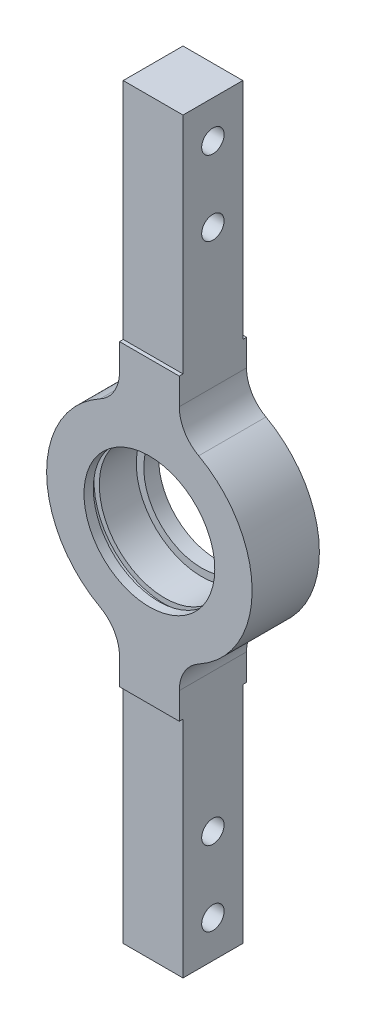
from build123d import *

# Parameters (mm, degrees)
SKETCH1_R           = 27.5
SKETCH1_R_2         = 15.5
BOSS_EXTRUDE1_DEPTH = 9
BOSS_EXTRUDE2_DEPTH = 9
SKETCH3_W           = 14
SKETCH3_H           = 2
SKETCH4_W           = 1.6
SKETCH4_H           = 1.9
FILLET1_R           = 10
SKETCH5_W           = 16
SKETCH5_H           = 1
CUT_EXTRUDE1_DEPTH  = 60
SKETCH6_R           = 3
CUT_EXTRUDE2_DEPTH  = 107.495305061
SKETCH7_R           = 3
CUT_EXTRUDE3_DEPTH  = 107.495305061


with BuildPart() as part:
    # Sketch1 → Boss-Extrude1 (new, symmetric)
    with BuildSketch(Plane.XY):
        Circle(SKETCH1_R)
        Circle(SKETCH1_R_2, mode=Mode.SUBTRACT)
    extrude(amount=BOSS_EXTRUDE1_DEPTH, both=True)

    # Sketch2 → Boss-Extrude2 (add, symmetric)
    with BuildSketch(Plane.XY):
        Polygon((-8, 100), (8, 100), (8, 26.310644234), (0, 27.5), (-8, 26.310644234), align=None)
    boss_extrude2 = extrude(amount=BOSS_EXTRUDE2_DEPTH, both=True)

    # Mirror1: Boss-Extrude2 across plane
    add(boss_extrude2.mirror(Plane.ZX))

    # Sketch3 → Cut-Revolve1 (revolve, cut)
    with BuildSketch(Plane(origin=(0, 0, 0), x_dir=(0, 0, -1), z_dir=(1, 0, 0)), mode=Mode.PRIVATE) as cut_revolve1_sk:
        with Locations((-2, 16.5)):
            Rectangle(SKETCH3_W, SKETCH3_H)
    revolve(cut_revolve1_sk.sketch.rotate(Axis((0, 0, 0), (0, 0, -1)), 90), axis=Axis((0, 0, 0), (0, 0, -1)), mode=Mode.SUBTRACT)

    # Sketch4 → Cut-Revolve2 (revolve, cut)
    with BuildSketch(Plane(origin=(0, 0, 0), x_dir=(0, 0, -1), z_dir=(1, 0, 0)), mode=Mode.PRIVATE) as cut_revolve2_sk:
        with Locations((-5.7, 17.95)):
            Rectangle(SKETCH4_W, SKETCH4_H)
    revolve(cut_revolve2_sk.sketch.rotate(Axis((0, 0, 0), (0, 0, -1)), 90), axis=Axis((0, 0, 0), (0, 0, -1)), mode=Mode.SUBTRACT)

    # Fillet1
    fillet1_edges = [part.edges().sort_by_distance(p)[0] for p in [
        (8, 26.310644234, 0),
        (-8, 26.310644234, 0),
        (8, -26.310644234, 0),
        (-8, -26.310644234, 0),
    ]]
    fillet(fillet1_edges, radius=FILLET1_R)

    # Sketch5 → Cut-Extrude1 (cut)
    with BuildSketch(Plane.XZ.offset(100)):
        with Locations((0, 8.5)):
            Rectangle(SKETCH5_W, SKETCH5_H)
        with Locations((0, -8.5)):
            Rectangle(SKETCH5_W, SKETCH5_H)
    cut_extrude1 = extrude(amount=-CUT_EXTRUDE1_DEPTH, mode=Mode.SUBTRACT)

    # Sketch6 → Cut-Extrude2 (cut, through all)
    with BuildSketch(Plane.ZY.offset(8)):
        with Locations(Location((0, 90, 0), (0, 0, 270))):
            Circle(SKETCH6_R)
        with Locations(Location((0, 70, 0), (0, 0, 270))):
            Circle(SKETCH6_R)
    extrude(amount=-CUT_EXTRUDE2_DEPTH, mode=Mode.SUBTRACT)

    # Sketch7 → Cut-Extrude3 (cut, through all)
    with BuildSketch(Plane.ZY.offset(8)):
        with Locations(Location((0, -90, 0), (0, 0, 270))):
            Circle(SKETCH7_R)
        with Locations(Location((0, -70, 0), (0, 0, 270))):
            Circle(SKETCH7_R)
    extrude(amount=-CUT_EXTRUDE3_DEPTH, mode=Mode.SUBTRACT)

    # Mirror2: Cut-Extrude1 across plane
    add(cut_extrude1.mirror(Plane.ZX), mode=Mode.SUBTRACT)


solid = part.part
